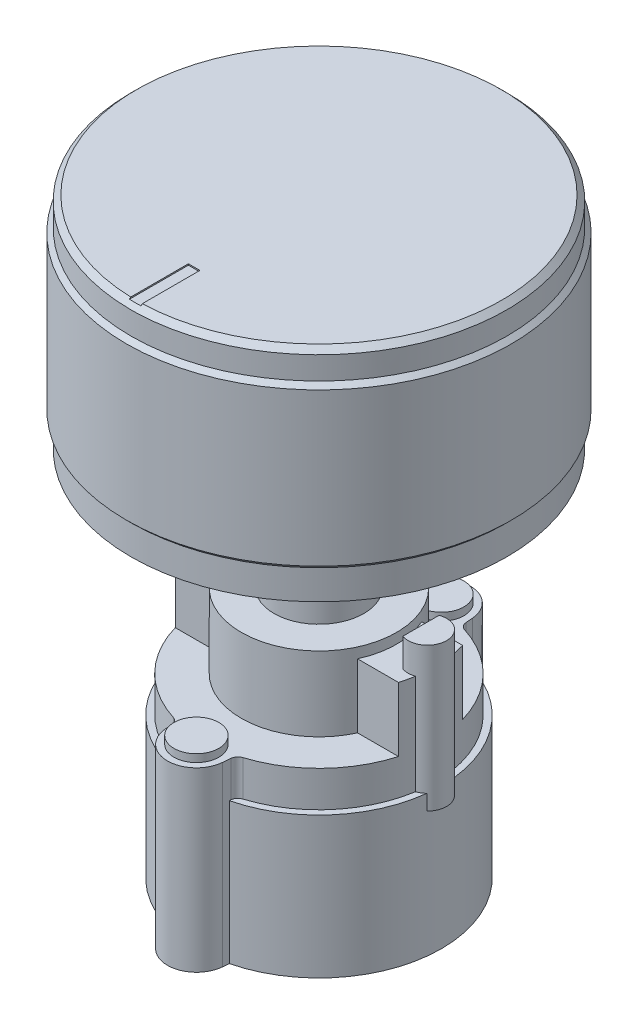
from build123d import *

# Parameters (mm, degrees)
EXTRUDE_1_DEPTH     = 5
EXTRUDE_START       = 2.2
EXTRUDE_2_DEPTH     = 11.2
EXTRUDE_3_REACH     = 40.643
SKETCH_6_R          = 1.75
EXTRUDE_4_DEPTH     = 0.6
SKETCH_7_W          = 0.9
SKETCH_7_H          = 10
CUT_EXTRUDE_1_DEPTH = 0.1


with BuildPart() as part:
    # 草圖2 → 旋轉1 (revolve)
    with BuildSketch(Plane(origin=(0, 0, 0), x_dir=(0, 0, -1), z_dir=(1, 0, 0)), mode=Mode.PRIVATE) as revolve_1_sk:
        Polygon((0, 15), (0, 17.1), (14.225735931, 17.1), (14.65, 16.675735931), (14.65, 14.9), (15, 14.55), (15, 2.65), (14.65, 2.3), (14.65, 0), (3, 0), (3, 15), align=None)
    revolve(revolve_1_sk.sketch.rotate(Axis((0, 22.612531688, 0), (0, -1, 0)), 180), axis=Axis((0, 22.612531688, 0), (0, -1, 0)))

    # 草圖7 → 除料-伸長1 (cut)
    with BuildSketch(Plane(origin=(0, 17.1, 0), x_dir=(1, 0, 0), z_dir=(0, 1, 0))):
        with Locations((0, -14.725735931)):
            Rectangle(SKETCH_7_W, SKETCH_7_H)
    extrude(amount=-CUT_EXTRUDE_1_DEPTH, mode=Mode.SUBTRACT)


with BuildPart() as body_2:
    # 草圖2<4> → 旋轉2 (revolve)
    with BuildSketch(Plane(origin=(0, 0, 0), x_dir=(0, 0, -1), z_dir=(1, 0, 0)), mode=Mode.PRIVATE) as revolve_2_sk:
        Polygon((3, 3.4), (3, 14.1), (2.25, 14.85), (0, 14.85), (0, -29), (9.55, -29), (9.55, -18), (9.05, -18), (9.05, -15.2), (6.05, -15.2), (6.05, -9.4), (3.5, -9.4), (3.5, -4.1), (3, -4.1), (3, -2.1), (2.25, -1.35), (2.25, 2.65), align=None)
    revolve(revolve_2_sk.sketch.rotate(Axis((0, 22.612531688, 0), (0, -1, 0)), 180), axis=Axis((0, 22.612531688, 0), (0, -1, 0)))

    # 草圖3 → 填料-伸長1 (add)
    with BuildSketch(Plane(origin=(0, -15.2, 0), x_dir=(1, 0, 0), z_dir=(0, 1, 0))):
        with BuildLine():
            Line((8.697844561, 2.5), (5.509310302, 2.5))
            Line((5.509310302, 2.5), (5.509310302, -2.5))
            Line((5.509310302, -2.5), (8.697844561, -2.5))
            ThreePointArc((8.697844561, -2.5), (9.05, 0), (8.697844561, 2.5))
        make_face()
        with BuildLine():
            Line((-5.509310302, 2.5), (-5.509310302, -2.5))
            Line((-5.509310302, -2.5), (-8.697844561, -2.5))
            ThreePointArc((-8.697844561, -2.5), (-9.05, 0), (-8.697844561, 2.5))
            Line((-8.697844561, 2.5), (-5.509310302, 2.5))
        make_face()
    extrude(amount=EXTRUDE_1_DEPTH)

    # 草圖4 → 填料-伸長2 (add)
    with BuildSketch(Plane(origin=(0, -10.2, 0), x_dir=(1, 0, 0), z_dir=(0, 1, 0)).offset(EXTRUDE_START)):
        with BuildLine():
            Line((7.95, 1.414213562), (7.95, -1.414213562))
            ThreePointArc((7.95, -1.414213562), (9.95, 0), (7.95, 1.414213562))
        make_face()
    extrude(amount=-EXTRUDE_2_DEPTH)

    # 填料-伸長3: up to this face of the body (flat: up to its plane)
    extrude_3_end = Plane(body_2.part.faces().sort_by_distance((0, -29, 0))[0])
    # 草圖5 → 填料-伸長3 (add, up to the picked face)
    with BuildSketch(Plane(origin=(0, -15.2, 0), x_dir=(1, 0, 0), z_dir=(0, 1, 0)), mode=Mode.PRIVATE) as extrude_3_sk1:
        with BuildLine():
            Line((-2.241438071, 9.746100421), (-2.293196033, 9.1545042))
            ThreePointArc((-2.293196033, 9.1545042), (-2.423204558, 8.830966631), (-2.711166976, 8.634354268))
            Line((-2.711166976, 8.634354268), (2.711166976, 8.634354268))
            ThreePointArc((2.711166976, 8.634354268), (2.423204558, 8.830966631), (2.293196033, 9.1545042))
            Line((2.293196033, 9.1545042), (2.241438071, 9.746100421))
            ThreePointArc((2.241438071, 9.746100421), (0, 11.8), (-2.241438071, 9.746100421))
        make_face()
    extrude_3_tool1 = split(extrude(extrude_3_sk1.sketch, amount=-EXTRUDE_3_REACH, mode=Mode.PRIVATE), bisect_by=extrude_3_end, keep=Keep.BOTH, mode=Mode.PRIVATE)
    # 草圖5 → 填料-伸長3 (add, up to the picked face)
    with BuildSketch(Plane(origin=(0, -15.2, 0), x_dir=(1, 0, 0), z_dir=(0, 1, 0)), mode=Mode.PRIVATE) as extrude_3_sk2:
        with BuildLine():
            Line((2.241438071, -9.746100421), (2.293196033, -9.1545042))
            ThreePointArc((2.293196033, -9.1545042), (2.423204558, -8.830966631), (2.711166976, -8.634354268))
            Line((2.711166976, -8.634354268), (-2.711166976, -8.634354268))
            ThreePointArc((-2.711166976, -8.634354268), (-2.423204558, -8.830966631), (-2.293196033, -9.1545042))
            Line((-2.293196033, -9.1545042), (-2.241438071, -9.746100421))
            ThreePointArc((-2.241438071, -9.746100421), (0, -11.8), (2.241438071, -9.746100421))
        make_face()
    extrude_3_tool2 = split(extrude(extrude_3_sk2.sketch, amount=-EXTRUDE_3_REACH, mode=Mode.PRIVATE), bisect_by=extrude_3_end, keep=Keep.BOTH, mode=Mode.PRIVATE)
    add(extrude_3_tool1.solids().sort_by(Axis((0, -15.2, -10.004484), (0, -1, 0)))[0])
    add(extrude_3_tool2.solids().sort_by(Axis((0, -15.2, 10.004484), (0, -1, 0)))[0])

    # 草圖6 → 填料-伸長4 (add)
    with BuildSketch(Plane(origin=(0, -15.2, 0), x_dir=(1, 0, 0), z_dir=(0, 1, 0))):
        with Locations(Location((0, 9.55, 0), (0, 0, 270))):
            Circle(SKETCH_6_R)
        with Locations(Location((0, -9.55, 0), (0, 0, 90))):
            Circle(SKETCH_6_R)
    extrude(amount=EXTRUDE_4_DEPTH)


solid = Compound([part.part, body_2.part])
